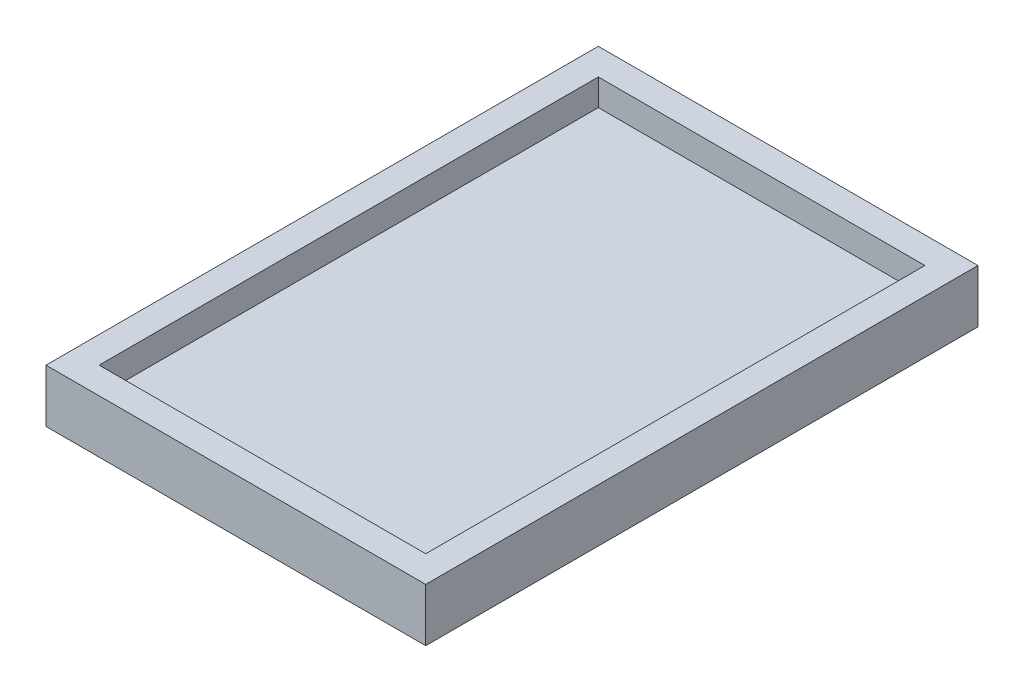
from build123d import *

# Parameters (mm, degrees)
SKETCH1_W           = 123
SKETCH1_H           = 188
BOSS_EXTRUDE1_DEPTH = 10
SHELL1_T            = 10


with BuildPart() as part:
    # Sketch1 → Boss-Extrude1 (new body)
    with BuildSketch(Plane(origin=(0, 0, 0), x_dir=(1, 0, 0), z_dir=(0, 1, 0))):
        Rectangle(SKETCH1_W, SKETCH1_H)
    extrude(amount=BOSS_EXTRUDE1_DEPTH)

    # Shell1
    shell1_openings = [part.faces().sort_by_distance(p)[0] for p in [
        (0, 10, 0),
    ]]
    offset(amount=SHELL1_T, openings=shell1_openings, kind=Kind.INTERSECTION)


solid = part.part
